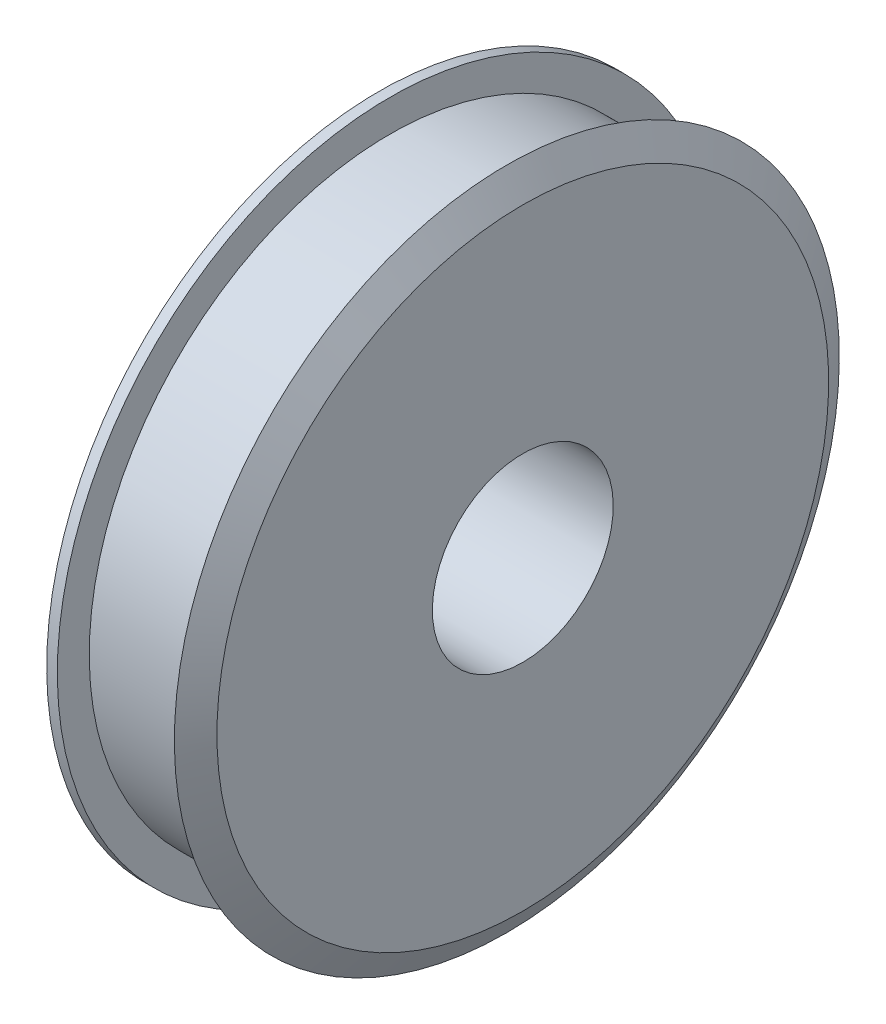
from build123d import *

# Parameters (mm, degrees)
ESQUISSE1_W             = 22
ESQUISSE1_H             = 56.5
ESQUISSE2_R             = 17
ENL_V_MAT_EXTRU_1_DEPTH = 93.420235879


with BuildPart() as part:
    # Esquisse1 → Révolution1 (revolve)
    with BuildSketch(Plane.XY, mode=Mode.PRIVATE) as r_volution1_sk:
        with Locations((-11, 28.25)):
            Rectangle(ESQUISSE1_W, ESQUISSE1_H)
        Polygon((0, 56.5), (0, 0), (3, 0), (3, 57.5), (0, 62.5), align=None)
        Polygon((-24, 0), (-22, 0), (-22, 56.5), (-22, 62.5), (-24, 62.5), align=None)
    revolve(r_volution1_sk.sketch.rotate(Axis((-24, 0, 0), (1, 0, 0)), 180), axis=Axis((-24, 0, 0), (1, 0, 0)))

    # Esquisse2 → Enlèv. mat.-Extru.1 (cut, through all)
    with BuildSketch(Plane.ZY.offset(24)):
        with Locations(Location((0, 0, 0), (0, 0, 270))):
            Circle(ESQUISSE2_R)
    extrude(amount=-ENL_V_MAT_EXTRU_1_DEPTH, mode=Mode.SUBTRACT)


solid = part.part
